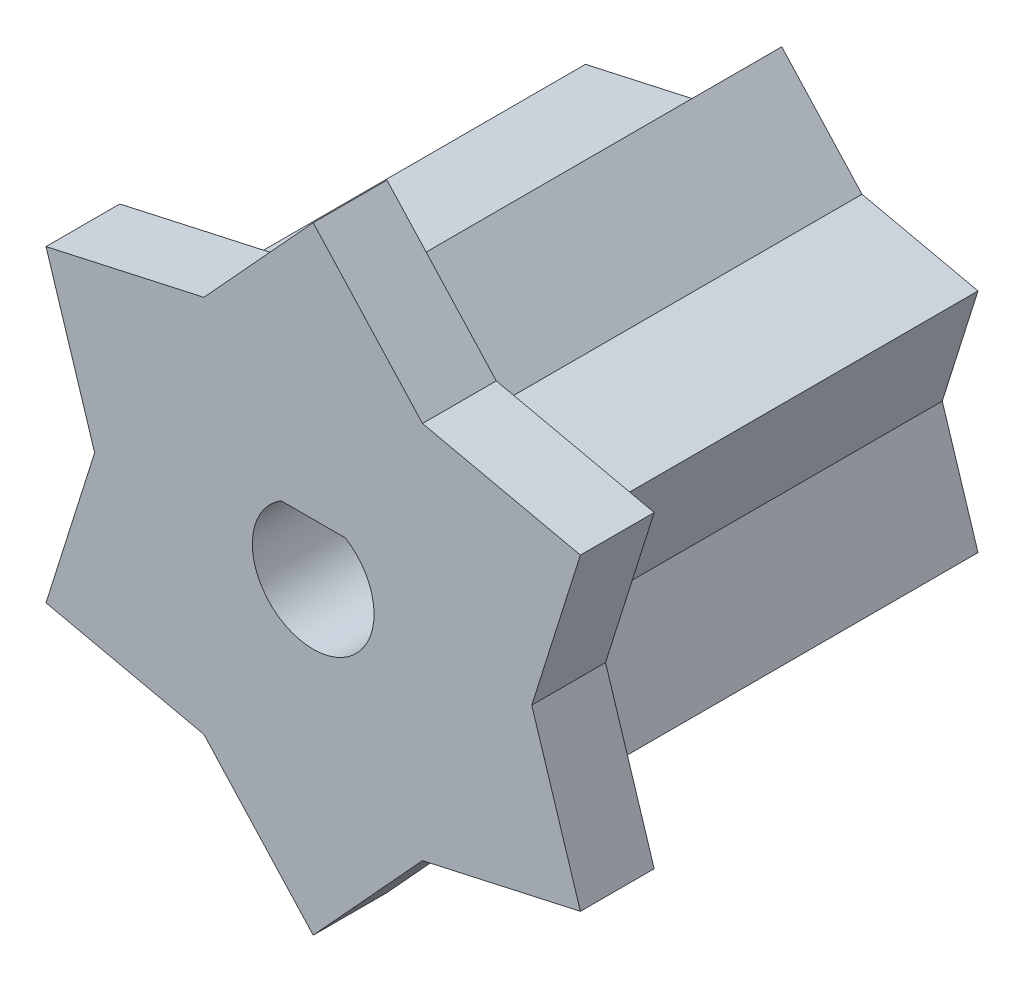
from build123d import *

# Parameters (mm, degrees)
BOSS_EXTRUDE1_DEPTH = 10.7
BOSS_EXTRUDE2_DEPTH = 2
CUT_EXTRUDE2_DEPTH  = 17.842989329
CHAMFER1_SIZE       = 0.4


with BuildPart() as part:
    # Sketch1 → Boss-Extrude1 (new body)
    with BuildSketch(Plane.XY):
        Polygon((2.175697935, 3.768419365), (0, 6.142777017), (-2.175697935, 3.768419365), (-5.319800946, 3.071388508), (-4.351395869, 0), (-5.319800946, -3.071388508), (-2.175697935, -3.768419365), (0, -6.142777017), (2.175697935, -3.768419365), (5.319800946, -3.071388508), (4.351395869, 0), (5.319800946, 3.071388508), align=None)
    extrude(amount=-BOSS_EXTRUDE1_DEPTH)

    # Sketch2 → Boss-Extrude2 (add)
    with BuildSketch(Plane.XY):
        Polygon((7.242620565, 4.181528933), (2.962094779, 5.130498653), (0, 8.363057866), (-2.962094779, 5.130498653), (-7.242620565, 4.181528933), (-5.924189557, 0), (-7.242620565, -4.181528933), (-2.962094779, -5.130498653), (0, -8.363057866), (2.962094779, -5.130498653), (7.242620565, -4.181528933), (5.924189557, 0), align=None)
    extrude(amount=BOSS_EXTRUDE2_DEPTH)

    # Sketch3 → Cut-Extrude2 (cut, through all)
    with BuildSketch(Plane.XY.offset(2)):
        with BuildLine():
            ThreePointArc((1.65, 0), (1.442792528, 0.800530899), (0.87321246, 1.4))
            Line((0.87321246, 1.4), (-0.87321246, 1.4))
            ThreePointArc((-0.87321246, 1.4), (-1.442792528, 0.800530899), (-1.65, 0))
            ThreePointArc((-1.65, 0), (0, -1.65), (1.65, 0))
        make_face()
    extrude(amount=-CUT_EXTRUDE2_DEPTH, mode=Mode.SUBTRACT)

    # Chamfer1
    chamfer1_edges = [part.edges().sort_by_distance(p)[0] for p in [
        (3.74774944, -3.419903937, 0),
        (1.087848967, -4.955598191, 0),
        (-1.087848967, -4.955598191, 0),
        (-3.74774944, -3.419903937, 0),
        (-4.835598408, -1.535694254, 0),
        (-4.835598408, 1.535694254, 0),
        (-3.74774944, 3.419903937, 0),
        (4.835598408, -1.535694254, 0),
        (4.835598408, 1.535694254, 0),
        (3.74774944, 3.419903937, 0),
        (1.087848967, 4.955598191, 0),
        (-1.087848967, 4.955598191, 0),
    ]]
    chamfer(chamfer1_edges, length=CHAMFER1_SIZE)


solid = part.part
